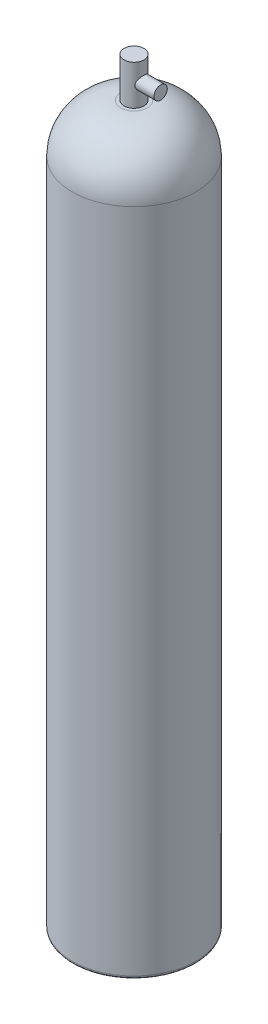
from build123d import *

# Parameters (mm, degrees)
SKETCH2_R           = 19.05
BOSS_EXTRUDE1_DEPTH = 76.2
SKETCH3_R           = 12.7
BOSS_EXTRUDE2_DEPTH = 50.8


with BuildPart() as part:
    # Sketch1 → Revolve1 (revolve)
    with BuildSketch(Plane.XY, mode=Mode.PRIVATE) as revolve1_sk:
        with BuildLine():
            Line((0, -1371.6), (111.76, -1371.6))
            ThreePointArc((111.76, -1371.6), (116.250128061, -1369.740128061), (118.11, -1365.25))
            Line((118.11, -1365.25), (118.11, -92.71))
            ThreePointArc((118.11, -92.71), (90.955869684, -27.154130316), (25.4, 0))
            Line((25.4, 0), (0, 0))
            Line((0, 0), (0, -12.7))
            Line((0, -12.7), (25.4, -12.7))
            ThreePointArc((25.4, -12.7), (81.975613563, -36.134386437), (105.41, -92.71))
            Line((105.41, -92.71), (105.41, -1358.9))
            Line((105.41, -1358.9), (0, -1358.9))
            Line((0, -1358.9), (0, -1371.6))
        make_face()
    revolve(revolve1_sk.sketch.rotate(Axis((0, -1371.6, 0), (0, 1, 0)), 90), axis=Axis((0, -1371.6, 0), (0, 1, 0)))

    # Sketch2 → Boss-Extrude1 (add)
    with BuildSketch(Plane(origin=(0, 0, 0), x_dir=(1, 0, 0), z_dir=(0, 1, 0))):
        with Locations(Location((0, 0, 0), (0, 0, 90))):
            Circle(SKETCH2_R)
    extrude(amount=BOSS_EXTRUDE1_DEPTH)

    # Sketch3 → Boss-Extrude2 (add)
    with BuildSketch(Plane(origin=(0, 0, 0), x_dir=(0, 0, -1), z_dir=(1, 0, 0))):
        with Locations(Location((0, 38.1, 0), (0, 0, 180))):
            Circle(SKETCH3_R)
    extrude(amount=BOSS_EXTRUDE2_DEPTH)


solid = part.part
